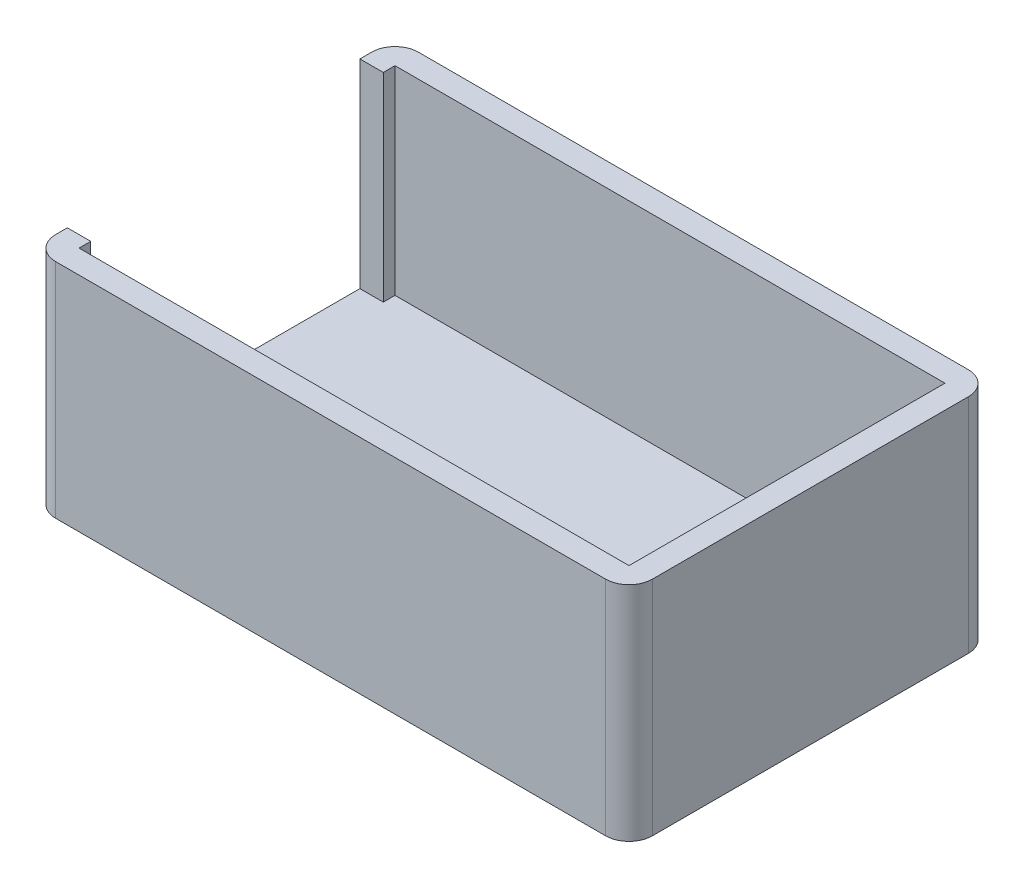
from build123d import *

# Parameters (mm, degrees)
SKETCH1_W           = 51
SKETCH1_H           = 31
BOSS_EXTRUDE1_DEPTH = 2
SKETCH2_W           = 2
SKETCH2_H           = 1
BOSS_EXTRUDE2_DEPTH = 17
FILLET3_R           = 2
FILLET4_R           = 2
FILLET5_R           = 2
FILLET6_R           = 2


with BuildPart() as part:
    # Sketch1 → Boss-Extrude1 (new body)
    with BuildSketch(Plane(origin=(0, 0, 0), x_dir=(1, 0, 0), z_dir=(0, 1, 0))):
        with Locations((25.5, 15.5)):
            Rectangle(SKETCH1_W, SKETCH1_H)
    extrude(amount=BOSS_EXTRUDE1_DEPTH)

    # Sketch2 → Boss-Extrude2 (add)
    with BuildSketch(Plane(origin=(0, 2, 0), x_dir=(1, 0, 0), z_dir=(0, 1, 0))):
        Polygon((49, 2), (49, 0), (51, 0), (51, 31), (49, 31), (49, 29), align=None)
        Polygon((0, 2), (0, 0), (49, 0), (49, 2), (2, 2), align=None)
        Polygon((2, 29), (49, 29), (49, 31), (0, 31), (0, 29), align=None)
        with Locations((1, 28.5)):
            Rectangle(SKETCH2_W, SKETCH2_H)
        with Locations((1, 2.5)):
            Rectangle(SKETCH2_W, SKETCH2_H)
    extrude(amount=BOSS_EXTRUDE2_DEPTH)

    # Fillet3
    fillet3_edges = [part.edges().sort_by_distance(p)[0] for p in [
        (51, 9.5, 0),
    ]]
    fillet(fillet3_edges, radius=FILLET3_R)

    # Fillet4
    fillet4_edges = [part.edges().sort_by_distance(p)[0] for p in [
        (51, 9.5, -31),
    ]]
    fillet(fillet4_edges, radius=FILLET4_R)

    # Fillet5
    fillet5_edges = [part.edges().sort_by_distance(p)[0] for p in [
        (0, 9.5, 0),
    ]]
    fillet(fillet5_edges, radius=FILLET5_R)

    # Fillet6
    fillet6_edges = [part.edges().sort_by_distance(p)[0] for p in [
        (0, 9.5, -31),
    ]]
    fillet(fillet6_edges, radius=FILLET6_R)


solid = part.part
